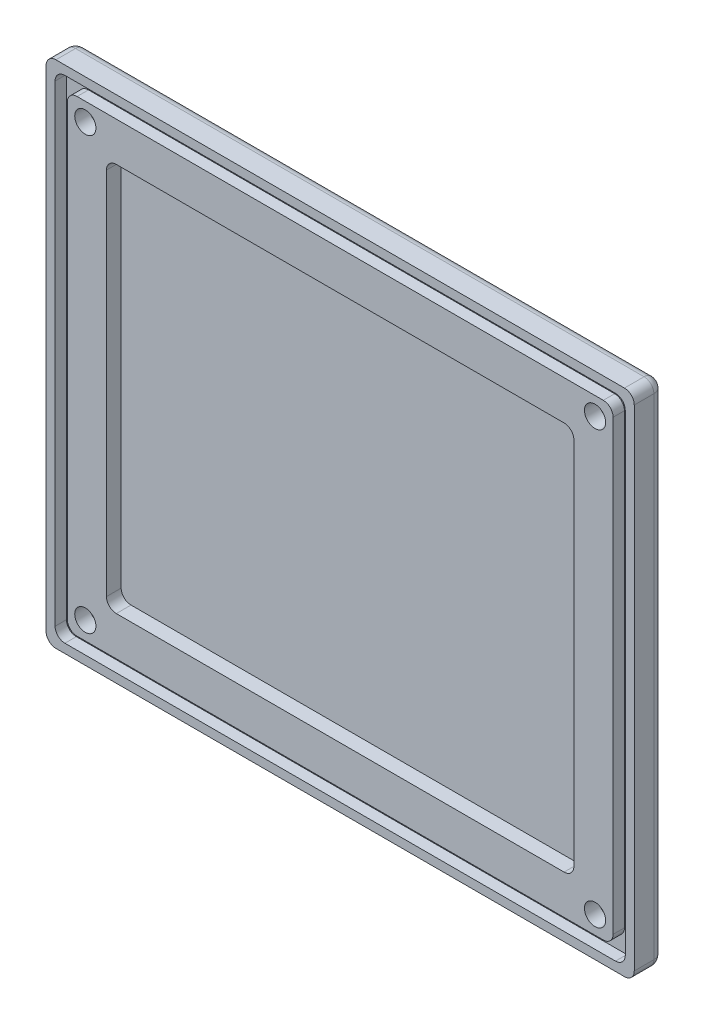
from build123d import *

# Parameters (mm, degrees)
SKETCH1_W                                  = 95.25
SKETCH1_H                                  = 82.55
BOSS_EXTRUDE1_DEPTH                        = 4.7625
SKETCH2_W                                  = 92.338000236
SKETCH2_H                                  = 79.638
SKETCH2_W_2                                = 88.392
SKETCH2_H_2                                = 75.692
CUT_EXTRUDE1_DEPTH                         = 1.8415
FILLET1_R                                  = 1.5875
FILLET2_R                                  = 1.5875
SKETCH3_R                                  = 1.7145
CUT_EXTRUDE2_DEPTH                         = 64.201642829
SKETCH4_R                                  = 3.048
CUT_EXTRUDE3_DEPTH                         = 2.38125
MIRROR1_AT_THE_SECOND_PLANE_COPY_1_SKETC_R = 1.7145
MIRROR1_AT_THE_SECOND_PLANE_COPY_1_DEPTH   = 64.201642829
MIRROR1_AT_THE_SECOND_PLANE_COPY_2_SKETC_R = 3.048
MIRROR1_AT_THE_SECOND_PLANE_COPY_2_DEPTH   = 2.38125
CUT_EXTRUDE4_DEPTH                         = 2.38125


with BuildPart() as part:
    # Sketch1 → Boss-Extrude1 (new body)
    with BuildSketch(Plane.XY):
        Rectangle(SKETCH1_W, SKETCH1_H)
    extrude(amount=BOSS_EXTRUDE1_DEPTH)

    # Sketch2 → Cut-Extrude1 (cut)
    with BuildSketch(Plane.XY.offset(4.7625)):
        Rectangle(SKETCH2_W, SKETCH2_H)
        Rectangle(SKETCH2_W_2, SKETCH2_H_2, mode=Mode.SUBTRACT)
    extrude(amount=-CUT_EXTRUDE1_DEPTH, mode=Mode.SUBTRACT)

    # Fillet1
    fillet1_edges = [part.edges().sort_by_distance(p)[0] for p in [
        (46.169000118, 39.819, 3.84175),
        (46.169000118, -39.819, 3.84175),
        (-46.169000118, -39.819, 3.84175),
        (-46.169000118, 39.819, 3.84175),
        (44.196, -37.846, 3.84175),
        (-44.196, -37.846, 3.84175),
        (-44.196, 37.846, 3.84175),
        (44.196, 37.846, 3.84175),
    ]]
    fillet(fillet1_edges, radius=FILLET1_R)

    # Fillet2
    fillet2_edges = [part.edges().sort_by_distance(p)[0] for p in [
        (0, -41.275, 0),
        (-47.625, 0, 0),
        (0, 41.275, 0),
        (47.625, 0, 0),
        (47.625, -41.275, 2.38125),
        (-47.625, -41.275, 2.38125),
        (-47.625, 41.275, 2.38125),
        (47.625, 41.275, 2.38125),
    ]]
    fillet(fillet2_edges, radius=FILLET2_R)

    # Sketch3 → Cut-Extrude2 (cut, through all)
    with BuildSketch(Plane(origin=(0, 0, 0), x_dir=(-1, 0, 0), z_dir=(0, 0, -1))):
        with Locations((-41.275, 34.925)):
            Circle(SKETCH3_R)
    cut_extrude2 = extrude(amount=-CUT_EXTRUDE2_DEPTH, mode=Mode.SUBTRACT)

    # Sketch4 → Cut-Extrude3 (cut)
    with BuildSketch(Plane(origin=(0, 0, 0), x_dir=(-1, 0, 0), z_dir=(0, 0, -1))):
        with Locations((-41.275, 34.925)):
            Circle(SKETCH4_R)
    cut_extrude3 = extrude(amount=-CUT_EXTRUDE3_DEPTH, mode=Mode.SUBTRACT)

    # Mirror1: Cut-Extrude2, Cut-Extrude3 across plane
    add(cut_extrude2.mirror(Plane(origin=(0, 0, 0), x_dir=(0, 0, 1), z_dir=(1, 0, 0))), mode=Mode.SUBTRACT)
    add(cut_extrude3.mirror(Plane(origin=(0, 0, 0), x_dir=(0, 0, 1), z_dir=(1, 0, 0))), mode=Mode.SUBTRACT)

    # Mirror1 at the second plane: Cut-Extrude2, Cut-Extrude3 across plane
    add(cut_extrude2.mirror(Plane.ZX), mode=Mode.SUBTRACT)
    add(cut_extrude3.mirror(Plane.ZX), mode=Mode.SUBTRACT)

    # Mirror1 at the second plane copy 1 sketc → Mirror1 at the second plane copy 1 (cut, through all)
    with BuildSketch(Plane(origin=(0, 0, 0), x_dir=(1, 0, 0), z_dir=(0, 0, -1))):
        with Locations((-41.275, 34.925)):
            Circle(MIRROR1_AT_THE_SECOND_PLANE_COPY_1_SKETC_R)
    extrude(amount=-MIRROR1_AT_THE_SECOND_PLANE_COPY_1_DEPTH, mode=Mode.SUBTRACT)

    # Mirror1 at the second plane copy 2 sketc → Mirror1 at the second plane copy 2 (cut)
    with BuildSketch(Plane(origin=(0, 0, 0), x_dir=(1, 0, 0), z_dir=(0, 0, -1))):
        with Locations((-41.275, 34.925)):
            Circle(MIRROR1_AT_THE_SECOND_PLANE_COPY_2_SKETC_R)
    extrude(amount=-MIRROR1_AT_THE_SECOND_PLANE_COPY_2_DEPTH, mode=Mode.SUBTRACT)

    # Sketch5 → Cut-Extrude4 (cut)
    with BuildSketch(Plane.XY.offset(4.7625)):
        with BuildLine():
            Line((-36.2585, -31.496), (36.2585, -31.496))
            ThreePointArc((36.2585, -31.496), (37.381032015, -31.031032015), (37.846, -29.9085))
            Line((37.846, -29.9085), (37.846, 29.9085))
            ThreePointArc((37.846, 29.9085), (37.381032015, 31.031032015), (36.2585, 31.496))
            Line((36.2585, 31.496), (-36.2585, 31.496))
            ThreePointArc((-36.2585, 31.496), (-37.381032015, 31.031032015), (-37.846, 29.9085))
            Line((-37.846, 29.9085), (-37.846, -29.9085))
            ThreePointArc((-37.846, -29.9085), (-37.381032015, -31.031032015), (-36.2585, -31.496))
        make_face()
    extrude(amount=-CUT_EXTRUDE4_DEPTH, mode=Mode.SUBTRACT)


solid = part.part
